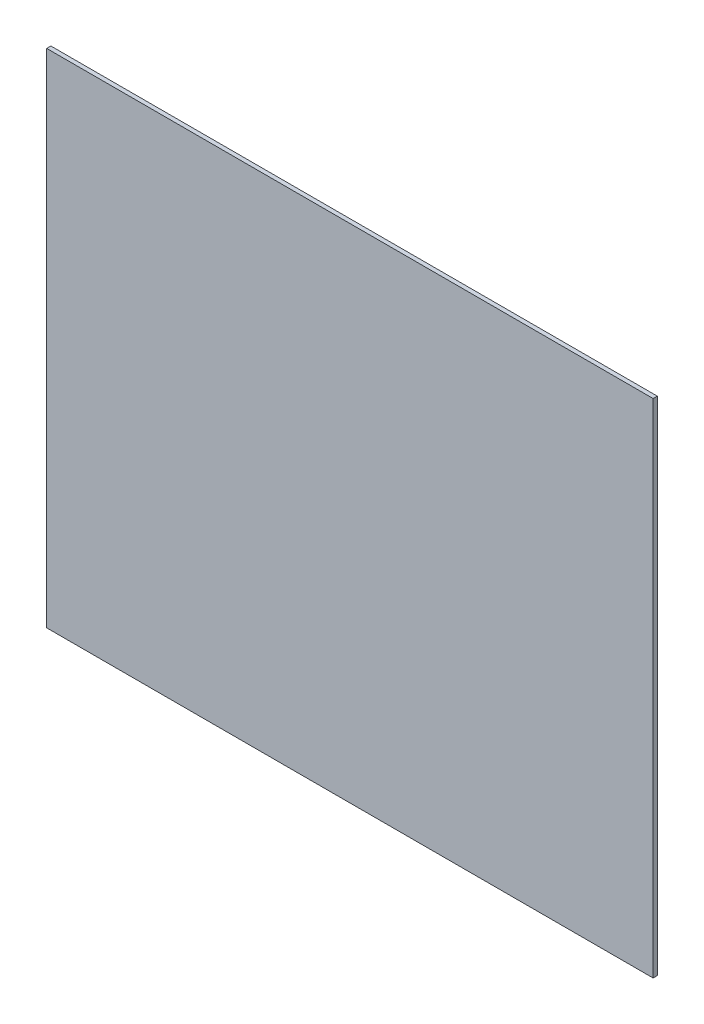
from build123d import *

# Parameters (mm, degrees)
SKETCH1_W           = 290
SKETCH1_H           = 240
BOSS_EXTRUDE1_DEPTH = 2


with BuildPart() as part:
    # Sketch1 → Boss-Extrude1 (new body)
    with BuildSketch(Plane.XY):
        with Locations((-145, 120)):
            Rectangle(SKETCH1_W, SKETCH1_H)
    extrude(amount=BOSS_EXTRUDE1_DEPTH)


solid = part.part
